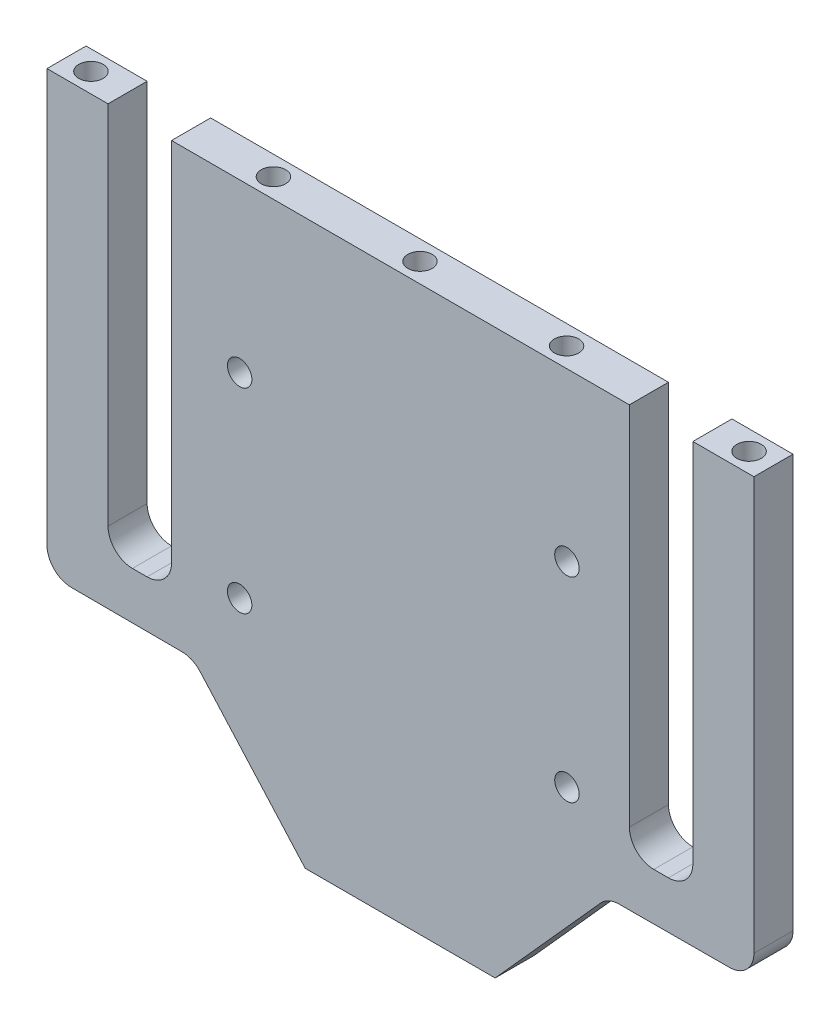
from build123d import *

# Parameters (mm, degrees)
BOSS_EXTRUDE1_DEPTH    = 8
SKETCH2_W              = 45
SKETCH2_H              = 52
CUT_EXTRUDE1_DEPTH     = 342.206659287
SPLIT1_SURFACE_1_BACK  = 343.199
SPLIT1_SURFACE_1_DEPTH = 686.398
SPLIT1_SURFACE_2_BACK  = 343.199
SPLIT1_SURFACE_2_DEPTH = 686.398
SKETCH5_R              = 2.5
CUT_EXTRUDE6_DEPTH     = 10
SKETCH4_R              = 2.5
CUT_EXTRUDE7_DEPTH     = 5.2
SKETCH6_R              = 2.5
CUT_EXTRUDE8_DEPTH     = 184.408541223


with BuildPart() as part:
    # Sketch1 → Boss-Extrude1 (new body)
    with BuildSketch(Plane.XY):
        with BuildLine():
            Line((70, 309.985818768), (85.299227191, 309.985818768))
            ThreePointArc((85.299227191, 309.985818768), (88.489017574, 308.836174247), (90.211957942, 305.915913694))
            Line((90.211957942, 305.915913694), (96.672728921, 271.790334282))
            ThreePointArc((96.672728921, 271.790334282), (97.06575438, 270.906904614), (97.621470019, 270.115641625))
            Line((97.621470019, 270.115641625), (139.950460317, 220.786053348))
            ThreePointArc((139.950460317, 220.786053348), (141.739336996, 217.746026552), (142.361429131, 214.274017901))
            Line((142.361429131, 214.274017901), (142.361429131, 30.859943174))
            ThreePointArc((142.361429131, 30.859943174), (140.896963037, 27.324409268), (137.361429131, 25.859943174))
            Line((137.361429131, 25.859943174), (114.717190871, 25.782318449))
            ThreePointArc((114.717190871, 25.782318449), (112.681998989, 25.341726514), (111.002773989, 24.110332733))
            Line((111.002773989, 24.110332733), (89.38285929, 0))
            Line((89.38285929, 0), (50.5, 0))
            Line((50.5, 0), (28.997226011, 24.110332733))
            ThreePointArc((28.997226011, 24.110332733), (27.318001011, 25.341726514), (25.282809129, 25.782318449))
            Line((25.282809129, 25.782318449), (2.638570869, 25.859943174))
            ThreePointArc((2.638570869, 25.859943174), (-0.896963037, 27.324409268), (-2.361429131, 30.859943174))
            Line((-2.361429131, 30.859943174), (-2.361429131, 214.274017901))
            ThreePointArc((-2.361429131, 214.274017901), (-1.739336996, 217.746026552), (0.049539683, 220.786053348))
            Line((0.049539683, 220.786053348), (42.261389271, 270.115641625))
            ThreePointArc((42.261389271, 270.115641625), (42.81710491, 270.906904614), (43.210130369, 271.790334282))
            Line((43.210130369, 271.790334282), (49.724618218, 305.923183314))
            ThreePointArc((49.724618218, 305.923183314), (51.449026762, 308.838533573), (54.635967087, 309.985818768))
            Line((54.635967087, 309.985818768), (70, 309.985818768))
        make_face()
        with BuildLine():
            Line((15.138570869, 35.492492662), (18.138570869, 35.492492662))
            ThreePointArc((18.138570869, 35.492492662), (21.674104775, 36.956958756), (23.138570869, 40.492492662))
            Line((23.138570869, 40.492492662), (23.138570869, 213.625959477))
            Line((23.138570869, 213.625959477), (10.138570869, 213.625959477))
            Line((10.138570869, 213.625959477), (10.138570869, 40.492492662))
            ThreePointArc((10.138570869, 40.492492662), (11.603036963, 36.956958756), (15.138570869, 35.492492662))
        make_face(mode=Mode.SUBTRACT)
        with BuildLine():
            Line((124.861429131, 35.492492662), (121.861429131, 35.492492662))
            ThreePointArc((121.861429131, 35.492492662), (118.325895225, 36.956958756), (116.861429131, 40.492492662))
            Line((116.861429131, 40.492492662), (116.861429131, 213.625959477))
            Line((116.861429131, 213.625959477), (129.861429131, 213.625959477))
            Line((129.861429131, 213.625959477), (129.861429131, 40.492492662))
            ThreePointArc((129.861429131, 40.492492662), (128.396963037, 36.956958756), (124.861429131, 35.492492662))
        make_face(mode=Mode.SUBTRACT)
    extrude(amount=BOSS_EXTRUDE1_DEPTH)

    # Sketch2 → Cut-Extrude1 (cut, through all)
    with BuildSketch(Plane.XY.offset(8)):
        with Locations((69.88285929, 180.008918923)):
            Rectangle(SKETCH2_W, SKETCH2_H)
    extrude(amount=-CUT_EXTRUDE1_DEPTH, mode=Mode.SUBTRACT)


with BuildPart() as body_2:
    # Split1: the piece behind the surface
    add(part.part)
    # Split1 surface: a surface, the sketch's curves swept straight by 686.398 mm
    with BuildLine(Plane(origin=(0, 0, 0), x_dir=(-1, 0, 0), z_dir=(0, 0, -1)).offset(-SPLIT1_SURFACE_1_BACK), mode=Mode.PRIVATE) as split1_surface_1_path:
        Line((-142.361429131, 115.359943174), (2.361429131, 115.359943174))
    split1_surface_1 = Shell.extrude(split1_surface_1_path.wire(), (0 * SPLIT1_SURFACE_1_DEPTH, 0 * SPLIT1_SURFACE_1_DEPTH, -1 * SPLIT1_SURFACE_1_DEPTH))
    split(bisect_by=split1_surface_1, keep=Keep.BOTTOM)

    # Sketch5 → Cut-Extrude6 (cut)
    with BuildSketch(Plane(origin=(0, 115.359943174, -115.359943174), x_dir=(1, 0, 0), z_dir=(0, -1, 0))):
        with Locations(Location((100, 119.359943174, 0), (0, 0, 90))):
            Circle(SKETCH5_R)
        with Locations(Location((2.638570869, 119.359943174, 0), (0, 0, 270))):
            Circle(SKETCH5_R)
        with Locations(Location((40, 119.359943174, 0), (0, 0, 270))):
            Circle(SKETCH5_R)
        with Locations(Location((70, 119.359943174, 0), (0, 0, 270))):
            Circle(SKETCH5_R)
        with Locations(Location((137.361429131, 119.359943174, 0), (0, 0, 270))):
            Circle(SKETCH5_R)
    extrude(amount=CUT_EXTRUDE6_DEPTH, mode=Mode.SUBTRACT)

    # Sketch6 → Cut-Extrude8 (cut, through all)
    with BuildSketch(Plane.XY.offset(8)):
        with Locations((37.078570869, 81.192492662)):
            Circle(SKETCH6_R)
        with Locations((104.078570869, 81.192492662)):
            Circle(SKETCH6_R)
        with Locations((104.078570869, 41.192492662)):
            Circle(SKETCH6_R)
        with Locations((37.078570869, 41.192492662)):
            Circle(SKETCH6_R)
    extrude(amount=-CUT_EXTRUDE8_DEPTH, mode=Mode.SUBTRACT)


with BuildPart() as part_1:
    add(part.part)

    # Split1: split by a surface, the side it looks to stays
    # Split1 surface: a surface, the sketch's curves swept straight by 686.398 mm
    with BuildLine(Plane(origin=(0, 0, 0), x_dir=(-1, 0, 0), z_dir=(0, 0, -1)).offset(-SPLIT1_SURFACE_2_BACK), mode=Mode.PRIVATE) as split1_surface_2_path:
        Line((-142.361429131, 115.359943174), (2.361429131, 115.359943174))
    split1_surface_2 = Shell.extrude(split1_surface_2_path.wire(), (0 * SPLIT1_SURFACE_2_DEPTH, 0 * SPLIT1_SURFACE_2_DEPTH, -1 * SPLIT1_SURFACE_2_DEPTH))
    split(bisect_by=split1_surface_2, keep=Keep.TOP)

    # Sketch4 → Cut-Extrude7 (cut)
    with BuildSketch(Plane(origin=(0, 115.359943174, 0), x_dir=(-1, 0, 0), z_dir=(0, -1, 0))):
        with Locations(Location((-70, -4, 0), (0, 0, 90))):
            Circle(SKETCH4_R)
        with Locations(Location((-40, -4, 0), (0, 0, 90))):
            Circle(SKETCH4_R)
        with Locations(Location((-100, -4, 0), (0, 0, 270))):
            Circle(SKETCH4_R)
        with Locations(Location((-137.361429131, -4, 0), (0, 0, 90))):
            Circle(SKETCH4_R)
        with Locations(Location((-3.888570869, -4, 0), (0, 0, 90))):
            Circle(SKETCH4_R)
    extrude(amount=-CUT_EXTRUDE7_DEPTH, mode=Mode.SUBTRACT)


solid = body_2.part
